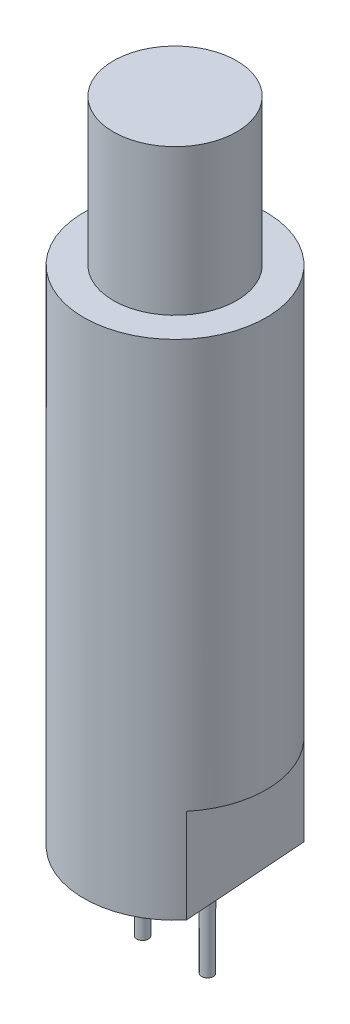
from build123d import *

# Parameters (mm, degrees)
SKETCH1_R           = 3.5687
BOSS_EXTRUDE1_DEPTH = 19.685
SKETCH2_R           = 2.413
BOSS_EXTRUDE2_DEPTH = 5.715
SKETCH3_R           = 0.2286
BOSS_EXTRUDE3_DEPTH = 3.683
CUT_EXTRUDE1_DEPTH  = 3.683


with BuildPart() as part:
    # Sketch1 → Boss-Extrude1 (new body)
    with BuildSketch(Plane(origin=(0, 0, 0), x_dir=(1, 0, 0), z_dir=(0, 1, 0))):
        with Locations(Location((0, 0, 0), (0, 0, 270))):
            Circle(SKETCH1_R)
    extrude(amount=BOSS_EXTRUDE1_DEPTH)

    # Sketch2 → Boss-Extrude2 (add)
    with BuildSketch(Plane(origin=(0, 19.685, 0), x_dir=(1, 0, 0), z_dir=(0, 1, 0))):
        with Locations(Location((0, 0, 0), (0, 0, 270))):
            Circle(SKETCH2_R)
    extrude(amount=BOSS_EXTRUDE2_DEPTH)

    # Sketch3 → Boss-Extrude3 (add)
    with BuildSketch(Plane.XZ):
        with Locations(Location((1.27, 0, 0), (0, 0, 90))):
            Circle(SKETCH3_R)
        with Locations(Location((-1.27, 0, 0), (0, 0, 90))):
            Circle(SKETCH3_R)
    extrude(amount=BOSS_EXTRUDE3_DEPTH)

    # Sketch4 → Cut-Extrude1 (cut)
    with BuildSketch(Plane.XZ):
        Polygon((2.738767967, 2.287961912), (2.390573782, -2.649674826), (3.144962665, -2.702873114), (4.333390191, 2.287961912), align=None)
    extrude(amount=-CUT_EXTRUDE1_DEPTH, mode=Mode.SUBTRACT)


solid = part.part
